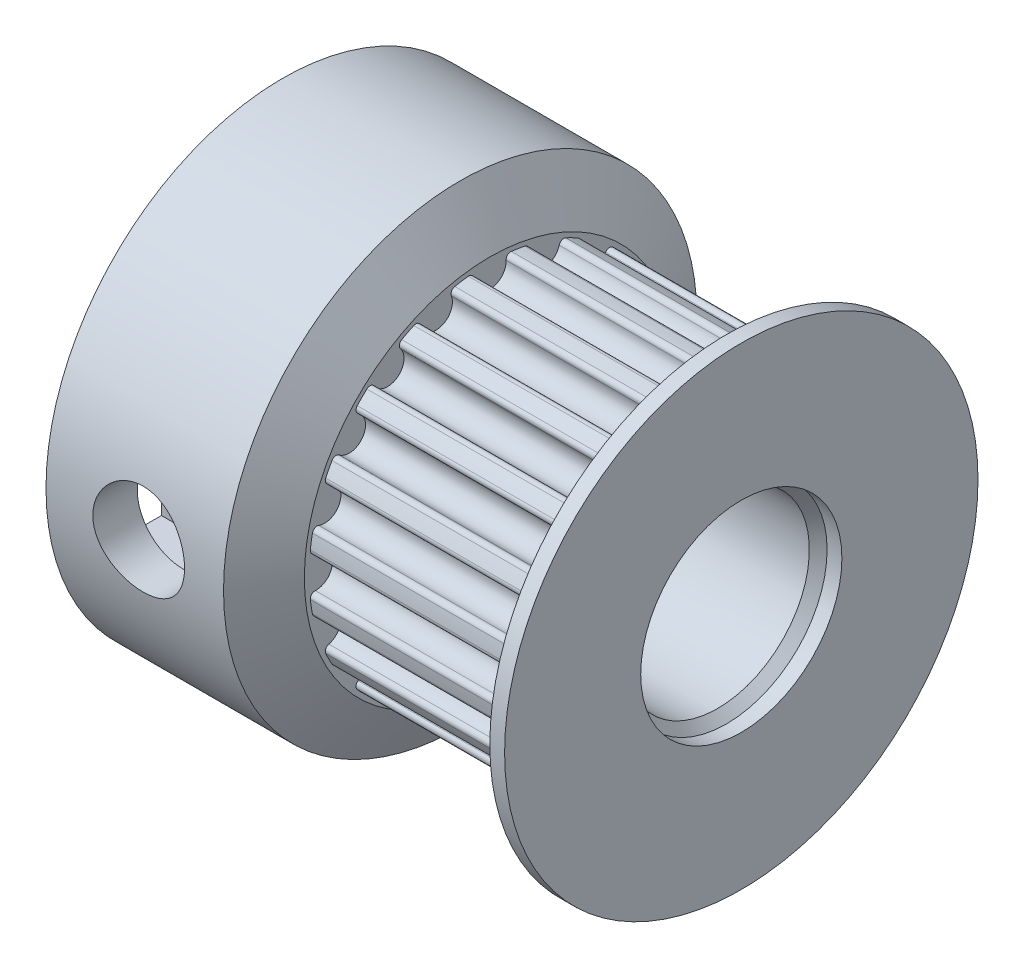
from build123d import *
from OCP.BRepFilletAPI import BRepFilletAPI_MakeChamfer

# Parameters (mm, degrees)
SKETCH_2_R                     = 3.1
BORE_DEPTH                     = 19.788294228
SKETCH_3_R                     = 0.55
CUT_EXTRUDE_20T_DEPTH          = 7
FILLET_2_R                     = 0.16
CHAMFER2_SIZE                  = 0.3
SKETCH1_W                      = 2.4
SKETCH1_H                      = 5.5
SKETCH1_W_2                    = 5.5
SKETCH1_H_2                    = 2.4
CUT_EXTRUDE1_DEPTH             = 6.35
CUT_EXTRUDE2_REACH             = 22.866
SKETCH2_R                      = 1.55
CUT_EXTRUDE2_DIRECTION_2_DEPTH = 21.866480394
CUT_EXTRUDE3_REACH             = 22.866
SKETCH3_R                      = 1.55
CUT_EXTRUDE3_DIRECTION_2_DEPTH = 21.866480394
SKETCH4_R                      = 8
SKETCH4_R_2                    = 3.4
BOSS_EXTRUDE1_DEPTH            = 0.5
CHAMFER3_SIZE                  = 1
CHAMFER3_SIZE2                 = 1.732050808


with BuildPart() as part:
    # Эскиз1 → Body (revolve)
    with BuildSketch(Plane.XY, mode=Mode.PRIVATE) as body_sk:
        Polygon((0, 7.213189396), (0, 0), (15, 0), (15, 8), (14, 8), (14, 7.213189396), (14, 6.11), (7, 6.11), (7, 7.213189396), (7, 8), (0, 8), align=None)
    revolve(body_sk.sketch.rotate(Axis((0, 0, 0), (1, 0, 0)), 90), axis=Axis((0, 0, 0), (1, 0, 0)))

    # Эскиз2 → Bore (cut, through all)
    with BuildSketch(Plane(origin=(15, 0, 0), x_dir=(0, 0, -1), z_dir=(1, 0, 0))):
        Circle(SKETCH_2_R)
    extrude(amount=-BORE_DEPTH, mode=Mode.SUBTRACT)

    # Эскиз3 → 20T (cut)
    with BuildSketch(Plane(origin=(7, 0, 0), x_dir=(0, 0, -1), z_dir=(1, 0, 0))):
        with Locations((5.582701751, -1.813929757)):
            Circle(SKETCH_3_R)
        with Locations((4.748929757, -3.450299431)):
            Circle(SKETCH_3_R)
        with Locations((3.450299431, -4.748929757)):
            Circle(SKETCH_3_R)
        with Locations((1.813929757, -5.582701751)):
            Circle(SKETCH_3_R)
        with Locations((0, -5.87)):
            Circle(SKETCH_3_R)
        with Locations((5.87, 0)):
            Circle(SKETCH_3_R)
        with Locations((-1.813929757, -5.582701751)):
            Circle(SKETCH_3_R)
        with Locations((-3.450299431, -4.748929757)):
            Circle(SKETCH_3_R)
        with Locations((-4.748929757, -3.450299431)):
            Circle(SKETCH_3_R)
        with Locations((-5.582701751, -1.813929757)):
            Circle(SKETCH_3_R)
        with Locations((-5.87, 0)):
            Circle(SKETCH_3_R)
        with Locations((-5.582701751, 1.813929757)):
            Circle(SKETCH_3_R)
        with Locations((-4.748929757, 3.450299431)):
            Circle(SKETCH_3_R)
        with Locations((-3.450299431, 4.748929757)):
            Circle(SKETCH_3_R)
        with Locations((-1.813929757, 5.582701751)):
            Circle(SKETCH_3_R)
        with Locations((0, 5.87)):
            Circle(SKETCH_3_R)
        with Locations((1.813929757, 5.582701751)):
            Circle(SKETCH_3_R)
        with Locations((3.450299431, 4.748929757)):
            Circle(SKETCH_3_R)
        with Locations((4.748929757, 3.450299431)):
            Circle(SKETCH_3_R)
        with Locations((5.582701751, 1.813929757)):
            Circle(SKETCH_3_R)
    extrude(amount=CUT_EXTRUDE_20T_DEPTH, mode=Mode.SUBTRACT)

    # Fillet 2
    fillet_2_edges = [part.edges().sort_by_distance(p)[0] for p in [
        (10.5, -3.170991479, 5.22273042),
        (10.5, -3.987221543, 4.629704566),
        (10.5, -1.401879653, 5.947002055),
        (10.5, -2.36141564, 5.635229913),
        (10.5, 0.504457922, 6.089139693),
        (10.5, -0.504457922, 6.089139693),
        (10.5, 2.36141564, 5.635229913),
        (10.5, 1.401879653, 5.947002055),
        (10.5, 3.987221543, 4.629704566),
        (10.5, 3.170991479, 5.22273042),
        (10.5, 5.22273042, 3.170991479),
        (10.5, 4.629704566, 3.987221543),
        (10.5, 5.947002055, 1.401879653),
        (10.5, 5.635229913, 2.36141564),
        (10.5, 6.089139693, -0.504457922),
        (10.5, 6.089139693, 0.504457922),
        (10.5, 5.635229913, -2.36141564),
        (10.5, 5.947002055, -1.401879653),
        (10.5, 4.629704566, -3.987221543),
        (10.5, 5.22273042, -3.170991479),
        (10.5, 3.170991479, -5.22273042),
        (10.5, 3.987221543, -4.629704566),
        (10.5, 1.401879653, -5.947002055),
        (10.5, 2.36141564, -5.635229913),
        (10.5, -2.36141564, -5.635229913),
        (10.5, -1.401879653, -5.947002055),
        (10.5, -3.987221543, -4.629704566),
        (10.5, -3.170991479, -5.22273042),
        (10.5, -5.22273042, -3.170991479),
        (10.5, -4.629704566, -3.987221543),
        (10.5, -5.947002055, -1.401879653),
        (10.5, -5.635229913, -2.36141564),
        (10.5, -6.089139693, 0.504457922),
        (10.5, -6.089139693, -0.504457922),
        (10.5, -0.504457922, -6.089139693),
        (10.5, 0.504457922, -6.089139693),
        (10.5, -5.635229913, 2.36141564),
        (10.5, -5.947002055, 1.401879653),
        (10.5, -4.629704566, 3.987221543),
        (10.5, -5.22273042, 3.170991479),
    ]]
    fillet(fillet_2_edges, radius=FILLET_2_R)

    # Chamfer2
    chamfer2_edges = [part.edges().sort_by_distance(p)[0] for p in [
        (0, 0, 3.1),
        (15, 0, 3.1),
    ]]
    chamfer(chamfer2_edges, length=CHAMFER2_SIZE)

    # Sketch1 → Cut-Extrude1 (cut)
    with BuildSketch(Plane.ZY):
        with Locations((5.3, 0)):
            Rectangle(SKETCH1_W, SKETCH1_H)
        with Locations((0, -5.3)):
            Rectangle(SKETCH1_W_2, SKETCH1_H_2)
    extrude(amount=-CUT_EXTRUDE1_DEPTH, mode=Mode.SUBTRACT)

    # Sketch2 → Cut-Extrude2 (cut, up to next)
    with BuildSketch(Plane.XY.offset(4.1), mode=Mode.PRIVATE) as cut_extrude2_sk1:
        with Locations(Location((3.132308546, 0, 0), (0, 0, 180))):
            Circle(SKETCH2_R)
    cut_extrude2_tool1 = extrude(cut_extrude2_sk1.sketch, amount=-CUT_EXTRUDE2_REACH, mode=Mode.PRIVATE) & part.part
    add(cut_extrude2_tool1.solids().sort_by_distance((3.132309, 0, 4.1))[0], mode=Mode.SUBTRACT)

    # Sketch2 → Cut-Extrude2 direction 2 (cut)
    with BuildSketch(Plane.XY.offset(4.1)):
        with Locations(Location((3.132308546, 0, 0), (0, 0, 180))):
            Circle(SKETCH2_R)
    extrude(amount=CUT_EXTRUDE2_DIRECTION_2_DEPTH, mode=Mode.SUBTRACT)

    # Sketch3 → Cut-Extrude3 (cut, up to next)
    with BuildSketch(Plane.XZ.offset(4.1), mode=Mode.PRIVATE) as cut_extrude3_sk1:
        with Locations(Location((3.132308546, 0, 0), (0, 0, 90))):
            Circle(SKETCH3_R)
    cut_extrude3_tool1 = extrude(cut_extrude3_sk1.sketch, amount=-CUT_EXTRUDE3_REACH, mode=Mode.PRIVATE) & part.part
    add(cut_extrude3_tool1.solids().sort_by_distance((3.132309, -4.1, 0))[0], mode=Mode.SUBTRACT)

    # Sketch3 → Cut-Extrude3 direction 2 (cut)
    with BuildSketch(Plane.XZ.offset(4.1)):
        with Locations(Location((3.132308546, 0, 0), (0, 0, 90))):
            Circle(SKETCH3_R)
    extrude(amount=CUT_EXTRUDE3_DIRECTION_2_DEPTH, mode=Mode.SUBTRACT)

    # Sketch4 → Boss-Extrude1 (add)
    with BuildSketch(Plane(origin=(15, 0, 0), x_dir=(0, 0, -1), z_dir=(1, 0, 0))):
        with Locations(Location((0, 0, 0), (0, 0, 180))):
            Circle(SKETCH4_R)
        with Locations(Location((0, 0, 0), (0, 0, 180))):
            Circle(SKETCH4_R_2, mode=Mode.SUBTRACT)
    extrude(amount=BOSS_EXTRUDE1_DEPTH)

    # Chamfer3: one chamfer whose edges measure the first distance from different faces: ONE call of the kernel's chamfer builder (chamfer() names one face for all edges)
    chamfer3_edges_1 = [part.edges().sort_by_distance(p)[0] for p in [
        (7, 0, -8),
    ]]
    chamfer3_side_1 = [part.faces().sort_by_distance(p)[0] for p in [
        (3.5, 0, -8),
    ]]
    chamfer3_edges_2 = [part.edges().sort_by_distance(p)[0] for p in [
        (14, 0, -8),
    ]]
    chamfer3_side_2 = [part.faces().sort_by_distance(p)[0] for p in [
        (14.75, 0, -8),
    ]]
    chamfer3 = BRepFilletAPI_MakeChamfer(part.part.solid().wrapped)
    for e in chamfer3_edges_1:
        chamfer3.Add(CHAMFER3_SIZE, CHAMFER3_SIZE2, e.wrapped, chamfer3_side_1[0].wrapped)  # the first distance lies on this face
    for e in chamfer3_edges_2:
        chamfer3.Add(CHAMFER3_SIZE, CHAMFER3_SIZE2, e.wrapped, chamfer3_side_2[0].wrapped)  # the first distance lies on this face
    add(Compound.cast(chamfer3.Shape()), mode=Mode.REPLACE)


solid = part.part
